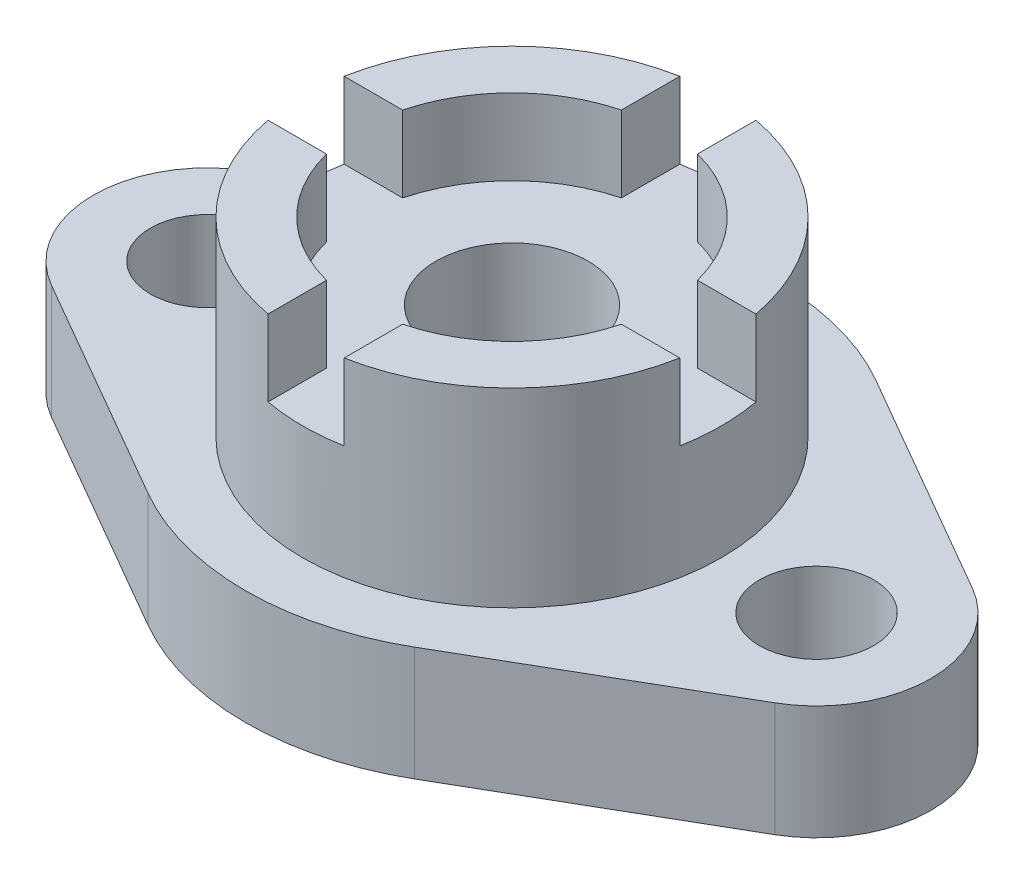
from build123d import *

# Parameters (mm, degrees)
BOSS_EXTRUDE1_DEPTH = 0.75
SKETCH2_R           = 0.375
CUT_EXTRUDE1_DEPTH  = 4.34477204
SKETCH3_R           = 1.375
BOSS_EXTRUDE2_DEPTH = 1.25
SKETCH5_R           = 0.5
CUT_EXTRUDE2_DEPTH  = 4.824264635
CUT_EXTRUDE3_START  = -0.5
CUT_EXTRUDE3_DEPTH  = 0.5


with BuildPart() as part:
    # Sketch1 → Boss-Extrude1 (new body)
    with BuildSketch(Plane(origin=(0, 0, 0), x_dir=(1, 0, 0), z_dir=(0, 1, 0))):
        with BuildLine():
            Line((-2.375, 0.649519053), (-0.875, 1.515544457))
            ThreePointArc((-0.875, 1.515544457), (0, 1.75), (0.875, 1.515544457))
            Line((0.875, 1.515544457), (2.375, 0.649519053))
            ThreePointArc((2.375, 0.649519053), (2.75, 0), (2.375, -0.649519053))
            Line((2.375, -0.649519053), (0.875, -1.515544457))
            ThreePointArc((0.875, -1.515544457), (0, -1.75), (-0.875, -1.515544457))
            Line((-0.875, -1.515544457), (-2.375, -0.649519053))
            ThreePointArc((-2.375, -0.649519053), (-2.75, 0), (-2.375, 0.649519053))
        make_face()
    extrude(amount=BOSS_EXTRUDE1_DEPTH)

    # Sketch2 → Cut-Extrude1 (cut, through all)
    with BuildSketch(Plane(origin=(0, 0.75, 0), x_dir=(1, 0, 0), z_dir=(0, 1, 0))):
        with Locations(Location((-2, 0, 0), (0, 0, 270))):
            Circle(SKETCH2_R)
        with Locations(Location((2, 0, 0), (0, 0, 270))):
            Circle(SKETCH2_R)
    extrude(amount=-CUT_EXTRUDE1_DEPTH, mode=Mode.SUBTRACT)

    # Sketch3 → Boss-Extrude2 (add)
    with BuildSketch(Plane(origin=(0, 0.75, 0), x_dir=(1, 0, 0), z_dir=(0, 1, 0))):
        with Locations(Location((0, 0, 0), (0, 0, 270))):
            Circle(SKETCH3_R)
    extrude(amount=BOSS_EXTRUDE2_DEPTH)

    # Sketch5 → Cut-Extrude2 (cut, through all)
    with BuildSketch(Plane(origin=(0, 2, 0), x_dir=(1, 0, 0), z_dir=(0, 1, 0))):
        with Locations(Location((0, 0, 0), (0, 0, 270))):
            Circle(SKETCH5_R)
    extrude(amount=-CUT_EXTRUDE2_DEPTH, mode=Mode.SUBTRACT)

    # Sketch6 → Cut-Extrude3 (cut)
    with BuildSketch(Plane(origin=(0, 2, 0), x_dir=(1, 0, 0), z_dir=(0, 1, 0)).offset(CUT_EXTRUDE3_START)):
        with BuildLine():
            Line((0.25, 1.352081728), (0.25, 0.968245837))
            ThreePointArc((0.25, 0.968245837), (0.707106781, 0.707106781), (0.968245837, 0.25))
            Line((0.968245837, 0.25), (1.352081728, 0.25))
            ThreePointArc((1.352081728, 0.25), (1.375, 0), (1.352081728, -0.25))
            Line((1.352081728, -0.25), (0.968245837, -0.25))
            ThreePointArc((0.968245837, -0.25), (0.707106781, -0.707106781), (0.25, -0.968245837))
            Line((0.25, -0.968245837), (0.25, -1.352081728))
            ThreePointArc((0.25, -1.352081728), (0, -1.375), (-0.25, -1.352081728))
            Line((-0.25, -1.352081728), (-0.25, -0.968245837))
            ThreePointArc((-0.25, -0.968245837), (-0.707106781, -0.707106781), (-0.968245837, -0.25))
            Line((-0.968245837, -0.25), (-1.352081728, -0.25))
            ThreePointArc((-1.352081728, -0.25), (-1.375, 0), (-1.352081728, 0.25))
            Line((-1.352081728, 0.25), (-0.968245837, 0.25))
            ThreePointArc((-0.968245837, 0.25), (-0.707106781, 0.707106781), (-0.25, 0.968245837))
            Line((-0.25, 0.968245837), (-0.25, 1.352081728))
            ThreePointArc((-0.25, 1.352081728), (0, 1.375), (0.25, 1.352081728))
        make_face()
    extrude(amount=CUT_EXTRUDE3_DEPTH, mode=Mode.SUBTRACT)


solid = part.part
